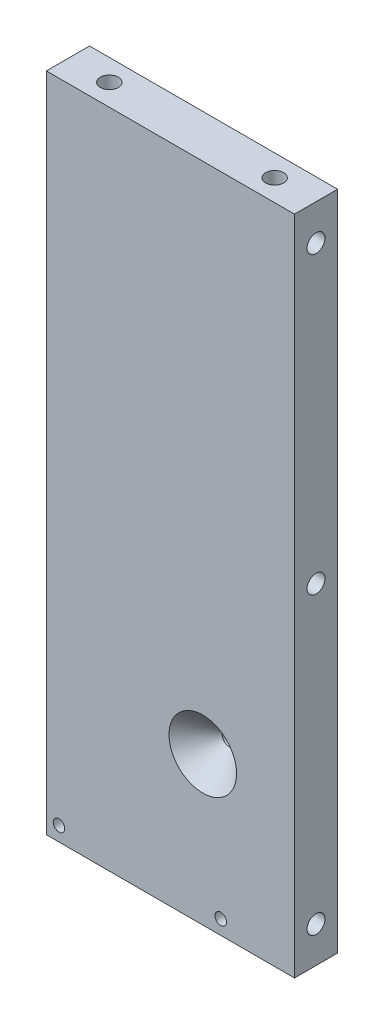
from build123d import *

# Parameters (mm, degrees)
SKETCH_1_W                 = 34.5
SKETCH_1_H                 = 92
EXTRUDE_717_DEPTH          = 6
HOLE_WIZARD_1_M3_D         = 2.5
HOLE_WIZARD_1_M3_DEPTH     = 6
HOLE_WIZARD_1_M3_TIP       = 0.751075774
HOLE_WIZARD_2_M3_D         = 2.5
HOLE_WIZARD_2_M3_DEPTH     = 6
HOLE_WIZARD_2_M3_TIP       = 0.751075774
HOLE_WIZARD_M3_D           = 2.5
HOLE_WIZARD_M3_DEPTH       = 6
HOLE_WIZARD_M3_TIP         = 0.751075774
HOLE_WIZARD_M3_2_D         = 2.5
HOLE_WIZARD_M3_2_DEPTH     = 6
HOLE_WIZARD_M3_2_TIP       = 0.751075774
HOLE_WIZARD_M4_D           = 2
HOLE_WIZARD_M4_CSINK_D     = 9.4
HOLE_WIZARD_M4_CSINK_ANGLE = 90
HOLE_WIZARD_M21_D          = 1.6


with BuildPart() as part:
    # Эскиз1 → Extrude 717 (new body)
    with BuildSketch(Plane.XY):
        Rectangle(SKETCH_1_W, SKETCH_1_H)
    extrude(amount=EXTRUDE_717_DEPTH)

    # Сторона-1-M3
    with Locations(Plane(origin=(17.25, 0, 0), x_dir=(0, 0, -1), z_dir=(1, 0, 0))):
        with Locations((-3, 41), (-3, 0), (-3, -41)):
            Hole(HOLE_WIZARD_1_M3_D / 2, depth=HOLE_WIZARD_1_M3_DEPTH)
            with Locations((0, 0, -(HOLE_WIZARD_1_M3_DEPTH + HOLE_WIZARD_1_M3_TIP / 2))):  # 118° drill point
                Cone(0, HOLE_WIZARD_1_M3_D / 2, HOLE_WIZARD_1_M3_TIP, mode=Mode.SUBTRACT)

    # Сторона-2-M3
    with Locations(Plane.ZY.offset(17.25)):
        with Locations((3, 0), (3, 41), (3, -41)):
            Hole(HOLE_WIZARD_2_M3_D / 2, depth=HOLE_WIZARD_2_M3_DEPTH)
            with Locations((0, 0, -(HOLE_WIZARD_2_M3_DEPTH + HOLE_WIZARD_2_M3_TIP / 2))):  # 118° drill point
                Cone(0, HOLE_WIZARD_2_M3_D / 2, HOLE_WIZARD_2_M3_TIP, mode=Mode.SUBTRACT)

    # Hole Wizard M3
    with Locations(Plane(origin=(0, -46, 0), x_dir=(-1, 0, 0), z_dir=(0, -1, 0))):
        with Locations((11.5, -3), (-11.5, -3)):
            Hole(HOLE_WIZARD_M3_D / 2, depth=HOLE_WIZARD_M3_DEPTH)
            with Locations((0, 0, -(HOLE_WIZARD_M3_DEPTH + HOLE_WIZARD_M3_TIP / 2))):  # 118° drill point
                Cone(0, HOLE_WIZARD_M3_D / 2, HOLE_WIZARD_M3_TIP, mode=Mode.SUBTRACT)

    # Hole Wizard M3 2
    with Locations(Plane(origin=(0, 46, 0), x_dir=(1, 0, 0), z_dir=(0, 1, 0))):
        with Locations((-11.5, -3), (11.5, -3)):
            Hole(HOLE_WIZARD_M3_2_D / 2, depth=HOLE_WIZARD_M3_2_DEPTH)
            with Locations((0, 0, -(HOLE_WIZARD_M3_2_DEPTH + HOLE_WIZARD_M3_2_TIP / 2))):  # 118° drill point
                Cone(0, HOLE_WIZARD_M3_2_D / 2, HOLE_WIZARD_M3_2_TIP, mode=Mode.SUBTRACT)

    # Натяжение-M4 (through all)
    with Locations(Plane.XY.offset(6)):
        with Locations((4.5, -25.4)):
            CounterSinkHole(HOLE_WIZARD_M4_D / 2, HOLE_WIZARD_M4_CSINK_D / 2, counter_sink_angle=HOLE_WIZARD_M4_CSINK_ANGLE)

    # Отверстие обработанное метчиком M21 (through all)
    with Locations(Plane.XY.offset(6)):
        with Locations((-15.5, -44), (7, -44)):
            Hole(HOLE_WIZARD_M21_D / 2)


solid = part.part
